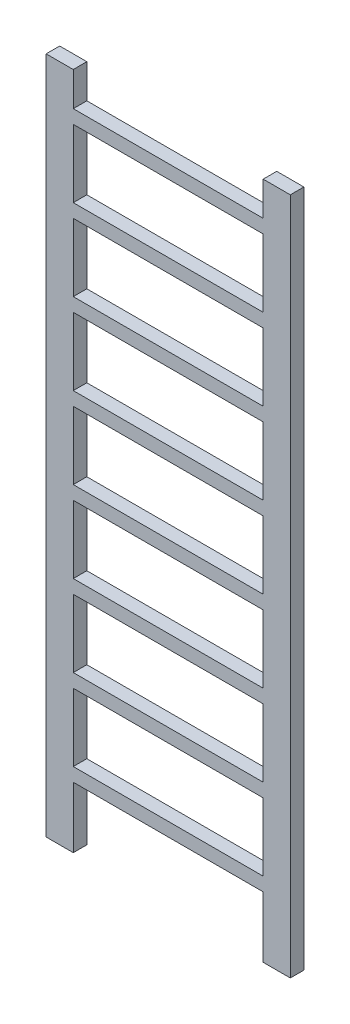
from build123d import *

# Parameters (mm, degrees)
SKETCH_1_W       = 100
SKETCH_1_H       = 2500
EXTRUDE_1_DEPTH  = 50
SKETCH_2_W       = 100
SKETCH_2_H       = 2500
EXTRUDE_2_DEPTH  = 50
SKETCH_3_W       = 800
SKETCH_3_H       = 50
EXTRUDE_3_DEPTH  = 50
SKETCH_4_W       = 800
SKETCH_4_H       = 50
EXTRUDE_4_DEPTH  = 50
SKETCH_5_W       = 800
SKETCH_5_H       = 50
EXTRUDE_5_DEPTH  = 50
SKETCH_6_W       = 800
SKETCH_6_H       = 50
EXTRUDE_6_DEPTH  = 50
SKETCH_7_W       = 800
SKETCH_7_H       = 50
EXTRUDE_7_DEPTH  = 50
SKETCH_8_W       = 800
SKETCH_8_H       = 50
EXTRUDE_8_DEPTH  = 50
SKETCH_9_W       = 800
SKETCH_9_H       = 50
EXTRUDE_9_DEPTH  = 50
SKETCH_10_W      = 800
SKETCH_10_H      = 50
EXTRUDE_10_DEPTH = 50


with BuildPart() as part:
    # 草图1 → 凸台-拉伸1 (new body)
    with BuildSketch(Plane.XY):
        with Locations((-400, 0)):
            Rectangle(SKETCH_1_W, SKETCH_1_H)
    extrude(amount=EXTRUDE_1_DEPTH)



with BuildPart() as body_2:
    # 草图2 → 凸台-拉伸2 (new body)
    with BuildSketch(Plane.XY):
        with Locations((400, 0)):
            Rectangle(SKETCH_2_W, SKETCH_2_H)
    extrude(amount=EXTRUDE_2_DEPTH)


with BuildPart() as part_1:
    add(part.part)

    add(body_2.part)  # 凸台-拉伸3 merges body 2
    # 草图3 → 凸台-拉伸3 (add)
    with BuildSketch(Plane.XY):
        with Locations((0, 1100)):
            Rectangle(SKETCH_3_W, SKETCH_3_H)
    extrude(amount=EXTRUDE_3_DEPTH)

    # 草图4 → 凸台-拉伸4 (add)
    with BuildSketch(Plane.XY):
        with Locations((0, 800)):
            Rectangle(SKETCH_4_W, SKETCH_4_H)
    extrude(amount=EXTRUDE_4_DEPTH)

    # 草图5 → 凸台-拉伸5 (add)
    with BuildSketch(Plane.XY):
        with Locations((0, 500)):
            Rectangle(SKETCH_5_W, SKETCH_5_H)
    extrude(amount=EXTRUDE_5_DEPTH)

    # 草图6 → 凸台-拉伸6 (add)
    with BuildSketch(Plane.XY):
        with Locations((0, 200)):
            Rectangle(SKETCH_6_W, SKETCH_6_H)
    extrude(amount=EXTRUDE_6_DEPTH)

    # 草图7 → 凸台-拉伸7 (add)
    with BuildSketch(Plane.XY):
        with Locations((0, -100)):
            Rectangle(SKETCH_7_W, SKETCH_7_H)
    extrude(amount=EXTRUDE_7_DEPTH)

    # 草图8 → 凸台-拉伸8 (add)
    with BuildSketch(Plane.XY):
        with Locations((0, -400)):
            Rectangle(SKETCH_8_W, SKETCH_8_H)
    extrude(amount=EXTRUDE_8_DEPTH)

    # 草图9 → 凸台-拉伸9 (add)
    with BuildSketch(Plane.XY):
        with Locations((0, -700)):
            Rectangle(SKETCH_9_W, SKETCH_9_H)
    extrude(amount=EXTRUDE_9_DEPTH)

    # 草图10 → 凸台-拉伸10 (add)
    with BuildSketch(Plane.XY):
        with Locations((0, -1000)):
            Rectangle(SKETCH_10_W, SKETCH_10_H)
    extrude(amount=EXTRUDE_10_DEPTH)


solid = part_1.part
